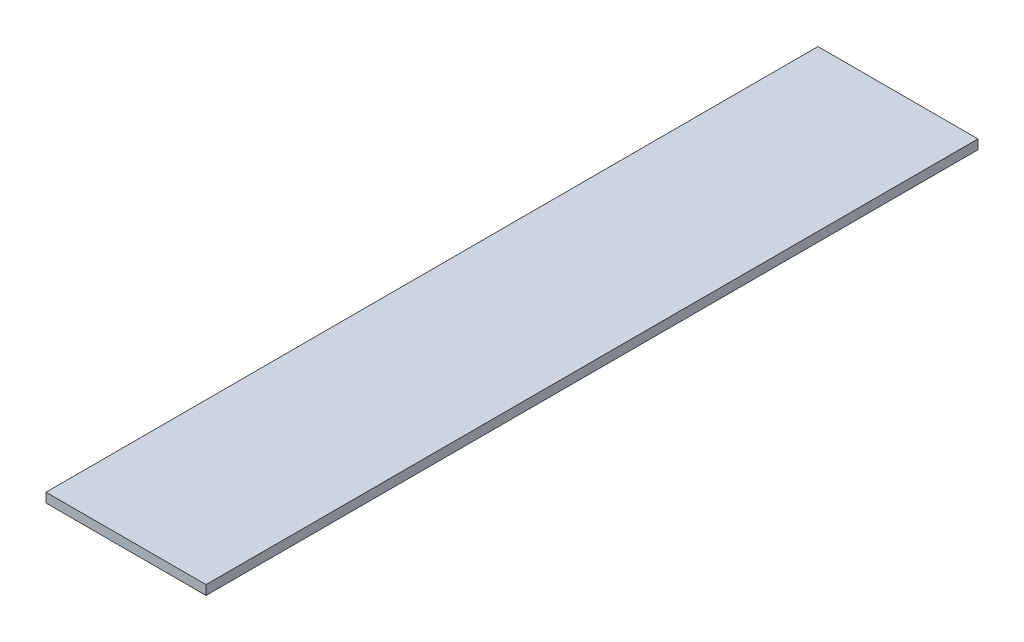
from build123d import *

# Parameters (mm, degrees)
SKETCH_1_W      = 170
SKETCH_1_H      = 10
EXTRUDE_1_DEPTH = 820


with BuildPart() as part:
    # Эскиз1 → Бобышка-Вытянуть1 (new body)
    with BuildSketch(Plane.XY):
        with Locations((85, 5)):
            Rectangle(SKETCH_1_W, SKETCH_1_H)
    extrude(amount=-EXTRUDE_1_DEPTH)


solid = part.part
